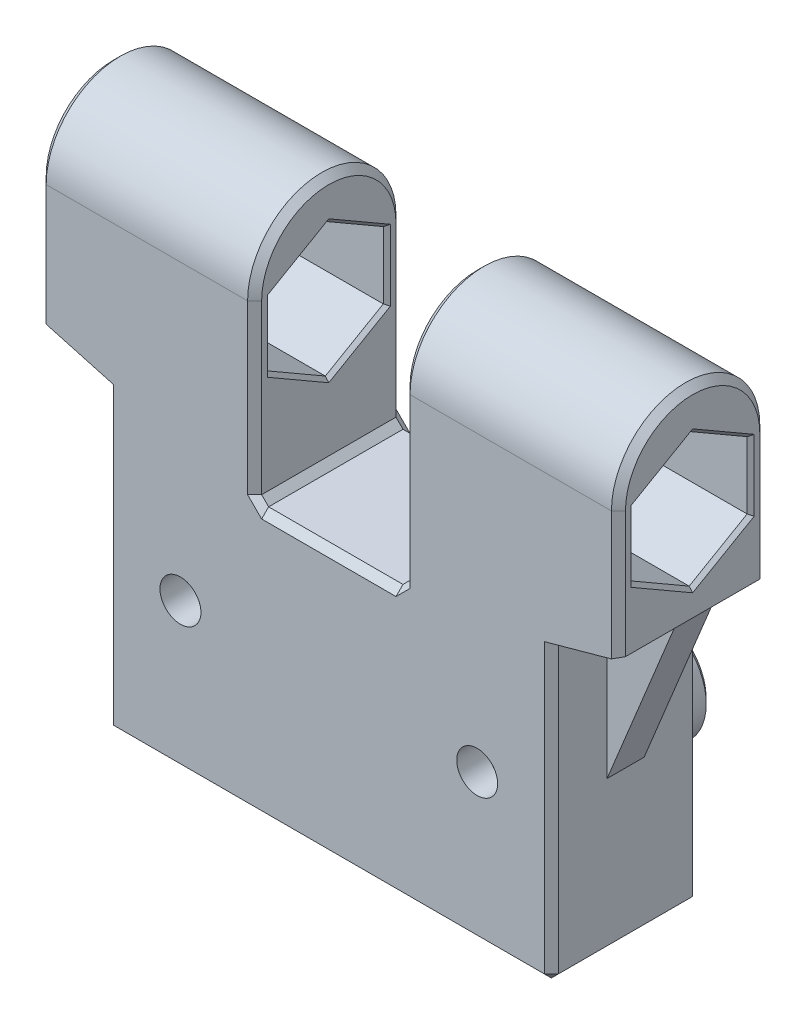
from build123d import *

# Parameters (mm, degrees)
SKETCH1_W                = 38.1
SKETCH1_H                = 12.7
SKETCH1_R                = 4.05
BOSS_EXTRUDE1_DEPTH      = 25.4
SKETCH5_R                = 1.7526
CUT_EXTRUDE2_DEPTH       = 35.195796525
SKETCH6_W                = 49.584
SKETCH6_H                = 12.7
BOSS_EXTRUDE4_DEPTH      = 19.05
CUT_EXTRUDE3_DEPTH       = 67.893183937
CUT_EXTRUDE4_DEPTH       = 67.893183937
CUT_EXTRUDE5_DEPTH       = 53.194652565
CHAMFER1_SIZE            = 0.6
SKETCH10_W               = 12.7
SKETCH10_H               = 25.4
CUT_EXTRUDE6_DEPTH       = 53.194652565
CHAMFER2_SIZE            = 0.6
CHAMFER3_SIZE            = 0.3
BOSS_EXTRUDE5_DEPTH      = 1.5875
BOSS_EXTRUDE5_DEPTH_BACK = 1.5875
SKETCH14_R               = 4.7625
BOSS_EXTRUDE6_DEPTH      = 2.54
SKETCH15_R               = 1.7526
CUT_EXTRUDE7_DEPTH       = 53.870117777
CHAMFER4_SIZE            = 0.4
SKETCH18_R               = 4.1
BOSS_EXTRUDE7_DEPTH      = 6.35


with BuildPart() as part:
    # Sketch1 → Boss-Extrude1 (new body)
    with BuildSketch(Plane(origin=(0, 0, 0), x_dir=(1, 0, 0), z_dir=(0, 1, 0))):
        Rectangle(SKETCH1_W, SKETCH1_H)
        with Locations(Location((12.7, 0, 0), (0, 0, 270))):
            Circle(SKETCH1_R, mode=Mode.SUBTRACT)
        with Locations(Location((-12.7, 0, 0), (0, 0, 90))):
            Circle(SKETCH1_R, mode=Mode.SUBTRACT)
    extrude(amount=BOSS_EXTRUDE1_DEPTH)

    # Sketch5 → Cut-Extrude2 (cut, through all)
    with BuildSketch(Plane.XY.offset(6.35)):
        with Locations((12.7, 12.7)):
            Circle(SKETCH5_R)
        with Locations((-12.7, 12.7)):
            Circle(SKETCH5_R)
    extrude(amount=-CUT_EXTRUDE2_DEPTH, mode=Mode.SUBTRACT)

    # Sketch6 → Boss-Extrude4 (add)
    with BuildSketch(Plane(origin=(0, 25.4, 0), x_dir=(1, 0, 0), z_dir=(0, 1, 0))):
        Rectangle(SKETCH6_W, SKETCH6_H)
    extrude(amount=BOSS_EXTRUDE4_DEPTH)

    # Sketch7 → Cut-Extrude3 (cut, through all)
    with BuildSketch(Plane.ZY.offset(24.792)):
        Polygon((0, 40.6552014), (-4.962499981, 37.7901007), (-4.962499981, 32.0598993), (0, 29.1947986), (4.962499981, 32.0598993), (4.962499981, 37.7901007), align=None)
    extrude(amount=-CUT_EXTRUDE3_DEPTH, mode=Mode.SUBTRACT)

    # Sketch8 → Cut-Extrude4 (cut, through all)
    with BuildSketch(Plane.ZY.offset(24.792)):
        with BuildLine():
            Line((-6.35, 37.7901007), (-6.35, 44.45))
            Line((-6.35, 44.45), (6.35, 44.45))
            Line((6.35, 44.45), (6.35, 37.7901007))
            ThreePointArc((6.35, 37.7901007), (0, 44.1401007), (-6.35, 37.7901007))
        make_face()
    extrude(amount=-CUT_EXTRUDE4_DEPTH, mode=Mode.SUBTRACT)

    # Sketch9 → Cut-Extrude5 (cut, through all)
    with BuildSketch(Plane(origin=(0, 0, -6.35), x_dir=(-1, 0, 0), z_dir=(0, 0, -1))):
        Polygon((19.05, 25.4), (24.792, 26.9875), (24.792, 25.4), align=None)
        Polygon((-24.792, 25.4), (-19.05, 25.4), (-24.792, 26.9875), align=None)
    extrude(amount=-CUT_EXTRUDE5_DEPTH, mode=Mode.SUBTRACT)

    # Chamfer1
    chamfer1_edges = [part.edges().sort_by_distance(p)[0] for p in [
        (19.05, 0, 0),
        (24.792, 32.38880035, 6.35),
        (24.792, 44.1401007, 0),
        (24.792, 32.38880035, -6.35),
        (21.921, 26.19375, -6.35),
        (19.05, 12.7, -6.35),
        (19.05, 12.7, 6.35),
        (-21.921, 26.19375, 6.35),
        (-24.792, 32.38880035, 6.35),
        (-24.792, 44.1401007, 0),
        (-24.792, 32.38880035, -6.35),
        (-21.921, 26.19375, -6.35),
        (0, 0, 6.35),
        (0, 0, -6.35),
        (-19.05, 12.7, 6.35),
        (-19.05, 0, 0),
        (-19.05, 12.7, -6.35),
    ]]
    chamfer(chamfer1_edges, length=CHAMFER1_SIZE)

    # Sketch10 → Cut-Extrude6 (cut, through all)
    with BuildSketch(Plane.XY.offset(6.35)):
        with Locations((0, 35.525)):
            Rectangle(SKETCH10_W, SKETCH10_H)
    extrude(amount=-CUT_EXTRUDE6_DEPTH, mode=Mode.SUBTRACT)

    # Chamfer2
    chamfer2_edges = [part.edges().sort_by_distance(p)[0] for p in [
        (-6.35, 44.1401007, 0),
        (6.35, 44.1401007, 0),
        (6.35, 30.30755035, -6.35),
        (-6.35, 30.30755035, -6.35),
        (-6.35, 22.825, 0),
        (6.35, 30.30755035, 6.35),
        (-6.35, 30.30755035, 6.35),
        (0, 22.825, 6.35),
        (0, 22.825, -6.35),
        (6.35, 22.825, 0),
    ]]
    chamfer(chamfer2_edges, length=CHAMFER2_SIZE)

    # Chamfer3
    chamfer3_edges = [part.edges().sort_by_distance(p)[0] for p in [
        (6.35, 34.925, 4.962499981),
        (6.35, 39.22265105, 2.481249991),
        (6.35, 39.22265105, -2.48124999),
        (6.35, 34.925, -4.962499981),
        (6.35, 30.62734895, -2.48124999),
        (6.35, 30.62734895, 2.481249991),
        (-6.35, 39.22265105, -2.48124999),
        (-6.35, 39.22265105, 2.481249991),
        (-6.35, 34.925, 4.962499981),
        (-6.35, 30.62734895, 2.481249991),
        (-6.35, 30.62734895, -2.48124999),
        (-6.35, 34.925, -4.962499981),
        (24.792, 39.22265105, 2.481249991),
        (24.792, 34.925, 4.962499981),
        (24.792, 30.62734895, 2.481249991),
        (24.792, 30.62734895, -2.48124999),
        (24.792, 34.925, -4.962499981),
        (24.792, 39.22265105, -2.481249991),
        (-24.792, 39.22265105, 2.481249991),
        (-24.792, 39.22265105, -2.48124999),
        (-24.792, 34.925, -4.962499981),
        (-24.792, 30.62734895, -2.48124999),
        (-24.792, 30.62734895, 2.481249991),
        (-24.792, 34.925, 4.962499981),
    ]]
    chamfer(chamfer3_edges, length=CHAMFER3_SIZE)

    # Sketch13 → Boss-Extrude5 (add, two sides: drawn at the far end of the back side and taken through both)
    with BuildSketch(Plane(origin=(0, 0, 0), x_dir=(0, -1, 0), z_dir=(0, 0, -1)).offset(-BOSS_EXTRUDE5_DEPTH_BACK)):
        Polygon((-25.4, 19.05), (-26.9875, 24.792), (-13, 19.05), align=None)
        Polygon((-26.9875, -24.792), (-13, -19.05), (-25.4, -19.05), align=None)
    extrude(amount=BOSS_EXTRUDE5_DEPTH + BOSS_EXTRUDE5_DEPTH_BACK)

    # Sketch14 → Boss-Extrude6 (add)
    with BuildSketch(Plane(origin=(0, 0, -6.35), x_dir=(-1, 0, 0), z_dir=(0, 0, -1))):
        with Locations(Location((-12.7, 12.7, 0), (0, 0, 180))):
            Circle(SKETCH14_R)
        with Locations(Location((12.7, 12.7, 0), (0, 0, 180))):
            Circle(SKETCH14_R)
    extrude(amount=BOSS_EXTRUDE6_DEPTH)

    # Sketch15 → Cut-Extrude7 (cut, through all)
    with BuildSketch(Plane.XY.offset(6.35)):
        with Locations((12.7, 12.7)):
            Circle(SKETCH15_R)
        with Locations((-12.7, 12.7)):
            Circle(SKETCH15_R)
    extrude(amount=-CUT_EXTRUDE7_DEPTH, mode=Mode.SUBTRACT)

    # Chamfer4
    chamfer4_edges = [part.edges().sort_by_distance(p)[0] for p in [
        (7.9375, 12.7, -6.35),
        (7.9375, 12.7, -8.89),
        (-17.4625, 12.7, -6.35),
        (-17.4625, 12.7, -8.89),
        (10.9474, 12.7, -8.89),
        (-14.4526, 12.7, -8.89),
    ]]
    chamfer(chamfer4_edges, length=CHAMFER4_SIZE)

    # Sketch18 → Boss-Extrude7 (add)
    with BuildSketch(Plane.XZ.offset(-25.4)):
        with Locations((-12.7, 0)):
            Circle(SKETCH18_R)
        with Locations((12.7, 0)):
            Circle(SKETCH18_R)
    extrude(amount=BOSS_EXTRUDE7_DEPTH)


solid = part.part
